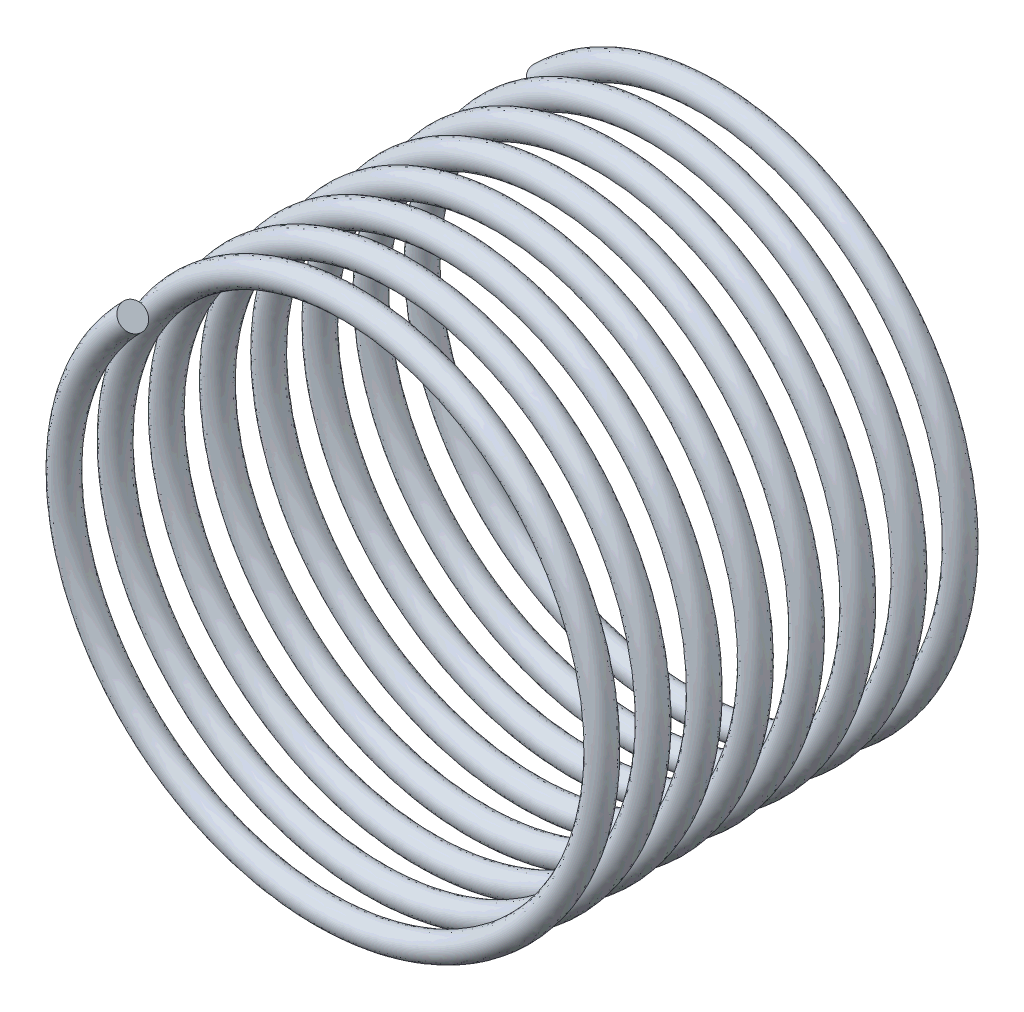
from build123d import *

# Parameters (mm, degrees)
SWEEP1_PITCH       = 10
SWEEP1_HEIGHT      = 80
SWEEP1_RADIUS      = 50
SWEEP1_START_ANGLE = 135
SWEEP1_PROFILE_R   = 2.5


with BuildPart() as part:
    # Sweep1: sweep along a helix
    with BuildLine() as sweep1_path:
        add(Helix(SWEEP1_PITCH, SWEEP1_HEIGHT, SWEEP1_RADIUS, center=(0, 0, 0), direction=(0, 0, 1), lefthand=True, mode=Mode.PRIVATE).rotate(Axis((0, 0, 0), (0, 0, 1)), SWEEP1_START_ANGLE))
    # Sweep1 profile (on start of the path) → Sweep1 (sweep)
    with BuildSketch(Plane(origin=(-35.355339059, 35.355339059, 0), x_dir=(-0.7071067811864733, 0.707106781186622, 0), z_dir=(0.7067488286947864, 0.7067488286946378, 0.031814875094914694))):
        Circle(SWEEP1_PROFILE_R)
    sweep(path=sweep1_path.line, is_frenet=True)


solid = part.part
